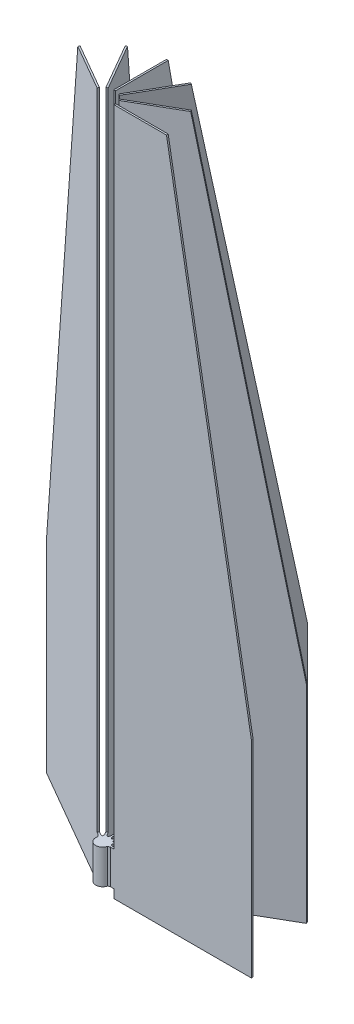
from build123d import *

# Parameters (mm, degrees)
BOSS_EXTRUDE1_DEPTH = 1
BOSS_EXTRUDE2_START = -5
SKETCH2_R           = 4
BOSS_EXTRUDE2_DEPTH = 20
BOSS_EXTRUDE3_DEPTH = 20
CIRPATTERN1_COUNT   = 6
CIRPATTERN1_ANGLE   = 150
CIRPATTERN2_COUNT   = 7
CIRPATTERN2_ANGLE   = 180


with BuildPart() as part:
    # Sketch1 → Boss-Extrude1 (new body)
    with BuildSketch(Plane.XY):
        Polygon((0, 0), (0, 20), (2, 20), (2, 395), (32.628445402, 395), (82, 115), (82, -5), (2, -5), (2, 0), align=None)
    boss_extrude1 = extrude(amount=BOSS_EXTRUDE1_DEPTH)



with BuildPart() as body_2:
    # Sketch2 → Boss-Extrude2 (new body)
    with BuildSketch(Plane.XZ.offset(5).offset(BOSS_EXTRUDE2_START)):
        with Locations((-5, 0.5)):
            Circle(SKETCH2_R)
    extrude(amount=-BOSS_EXTRUDE2_DEPTH)


with BuildPart() as part_1:
    add(part.part)

    add(body_2.part)  # Boss-Extrude3 merges body 2
    # Sketch3 → Boss-Extrude3 (add)
    with BuildSketch(Plane.XZ):
        with BuildLine():
            Line((0, 1), (-1.136296695, 1.53527618))
            ThreePointArc((-1.136296695, 1.53527618), (-1, 0.5), (-1.136296695, -0.53527618))
            Line((-1.136296695, -0.53527618), (0, 0))
            Line((0, 0), (0, 1))
        make_face()
    boss_extrude3 = extrude(amount=-BOSS_EXTRUDE3_DEPTH)

    # CirPattern1: Boss-Extrude3 ×6 about axis
    cirpattern1_axis = Axis((-5, 0, 0.5), (0, 1, 0))
    for i in range(1, CIRPATTERN1_COUNT):
        add(boss_extrude3.rotate(cirpattern1_axis, i * CIRPATTERN1_ANGLE / (CIRPATTERN1_COUNT - 1)))

    # CirPattern2: Boss-Extrude1 ×7 about axis, 1 skipped
    cirpattern2_axis = Axis((-5, 0, 0.5), (0, 1, 0))
    add([boss_extrude1.rotate(cirpattern2_axis, i * CIRPATTERN2_ANGLE / (CIRPATTERN2_COUNT - 1)) for i in range(1, CIRPATTERN2_COUNT) if i not in (6,)])


solid = part_1.part
